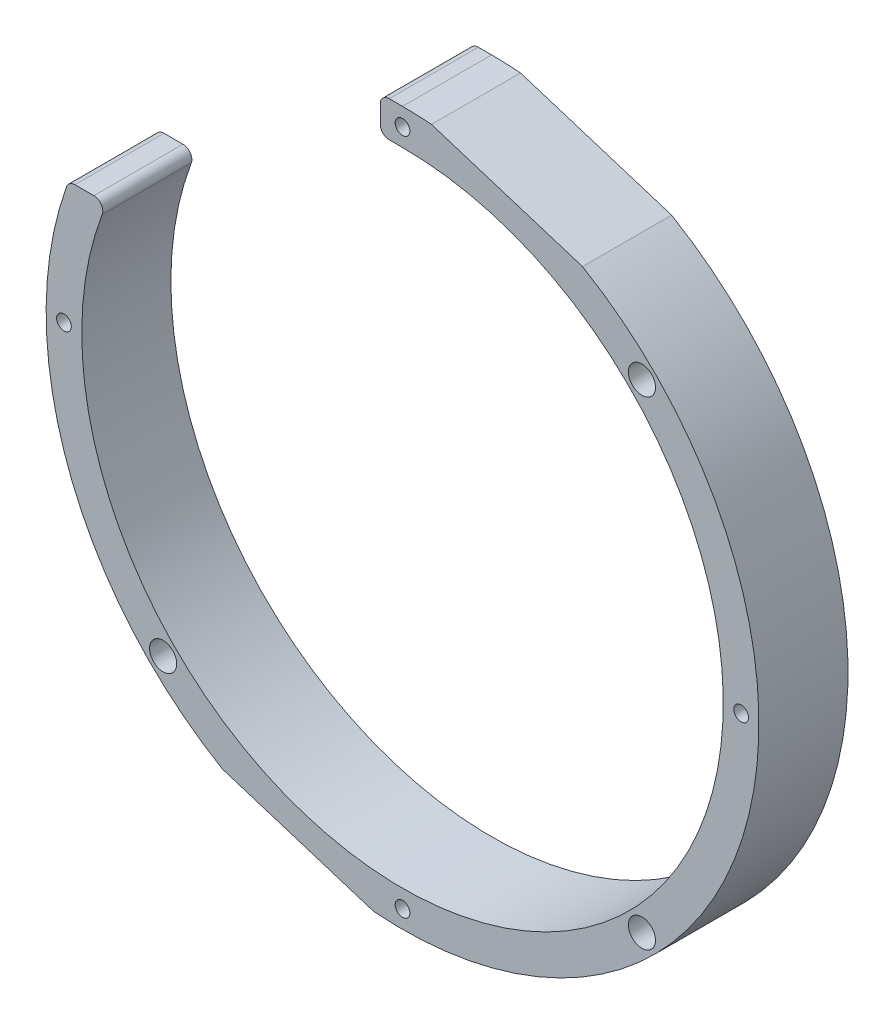
from build123d import *

# Parameters (mm, degrees)
SKETCH_1_R          = 80
SKETCH_1_R_2        = 72
EXTRUDE_1_DEPTH     = 20
SKETCH_2_W          = 88.50052384
SKETCH_2_H          = 52
CUT_EXTRUDE_1_DEPTH = 20
SKETCH_3_W          = 5
SKETCH_3_H          = 8
EXTRUDE_2_DEPTH     = 20
FILLET_1_R          = 2
SKETCH_4_R          = 1.65
CUT_EXTRUDE_2_DEPTH = 20
SKETCH_5_R          = 3.05
CUT_EXTRUDE_3_DEPTH = 30
CUT_EXTRUDE_4_DEPTH = 50


with BuildPart() as part:
    # 草图1 → 凸台-拉伸1 (new body)
    with BuildSketch(Plane.XY):
        Circle(SKETCH_1_R)
        Circle(SKETCH_1_R_2, mode=Mode.SUBTRACT)
    extrude(amount=EXTRUDE_1_DEPTH)

    # 草图2 → 切除-拉伸1 (cut)
    with BuildSketch(Plane.XY.offset(20)):
        with Locations((-44.25026192, 54)):
            Rectangle(SKETCH_2_W, SKETCH_2_H)
    extrude(amount=-CUT_EXTRUDE_1_DEPTH, mode=Mode.SUBTRACT)

    # 草图3 → 凸台-拉伸2 (add)
    with BuildSketch(Plane.XY.offset(20)):
        with Locations((-2.5, 76)):
            Rectangle(SKETCH_3_W, SKETCH_3_H)
    extrude(amount=-EXTRUDE_2_DEPTH)

    # 圆角1
    fillet_1_edges = [part.edges().sort_by_distance(p)[0] for p in [
        (-66.332495807, 28, 10),
        (-74.939975981, 28, 10),
        (-5, 72, 10),
        (-5, 80, 10),
    ]]
    fillet(fillet_1_edges, radius=FILLET_1_R)

    # 草图4 → 切除-拉伸2 (cut)
    with BuildSketch(Plane.XY.offset(20)):
        with Locations((-76, 0)):
            Circle(SKETCH_4_R)
        with Locations((0, -76)):
            Circle(SKETCH_4_R)
        with Locations((76, 0)):
            Circle(SKETCH_4_R)
        with Locations((0, 76)):
            Circle(SKETCH_4_R)
    extrude(amount=-CUT_EXTRUDE_2_DEPTH, mode=Mode.SUBTRACT)

    # 草图5 → 切除-拉伸3 (cut)
    with BuildSketch(Plane.XY.offset(20)):
        with Locations((53.74011537, 53.74011537)):
            Circle(SKETCH_5_R)
        with Locations((53.74011537, -53.74011537)):
            Circle(SKETCH_5_R)
        with Locations((-53.74011537, -53.74011537)):
            Circle(SKETCH_5_R)
    extrude(amount=-CUT_EXTRUDE_3_DEPTH, mode=Mode.SUBTRACT)

    # 草图7 → 切除-拉伸4 (cut)
    with BuildSketch(Plane.XY.offset(20)):
        Polygon((6.869093861, -83.94322558), (-55.146771426, -64.405783947), (-66.191379441, -99.463645444), (-4.175514154, -119.001087078), align=None)
        Polygon((-8.271771426, 84.385124293), (53.744093861, 64.84768266), (64.788701876, 99.905544157), (2.772836589, 119.44298579), align=None)
    extrude(amount=-CUT_EXTRUDE_4_DEPTH, mode=Mode.SUBTRACT)


solid = part.part
